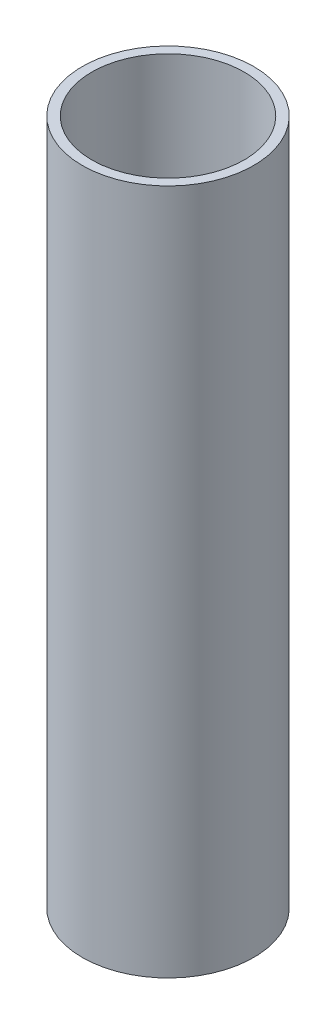
from build123d import *

# Parameters (mm, degrees)
SKETCH1_R           = 57.15
SKETCH1_R_2         = 50.8
BOSS_EXTRUDE1_DEPTH = 228.6


with BuildPart() as part:
    # Sketch1 → Boss-Extrude1 (new, symmetric)
    with BuildSketch(Plane(origin=(0, 0, 0), x_dir=(1, 0, 0), z_dir=(0, 1, 0))):
        with Locations(Location((0, 0, 0), (0, 0, 270))):
            Circle(SKETCH1_R)
        with Locations(Location((0, 0, 0), (0, 0, 270))):
            Circle(SKETCH1_R_2, mode=Mode.SUBTRACT)
    extrude(amount=BOSS_EXTRUDE1_DEPTH, both=True)


solid = part.part
